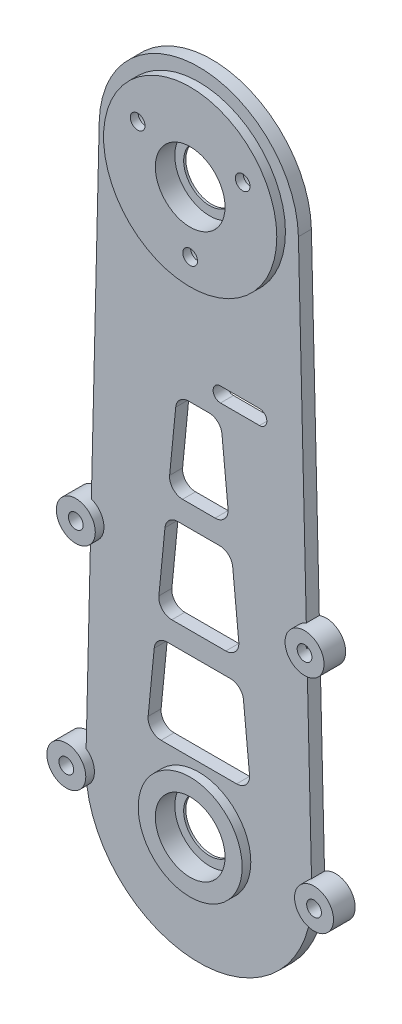
from build123d import *

# Parameters (mm, degrees)
SKETCH1_R           = 6
SKETCH1_R_2         = 1.7
BOSS_EXTRUDE1_DEPTH = 3
SKETCH2_R           = 20
SKETCH2_R_2         = 6
SKETCH2_R_3         = 1.7
BOSS_EXTRUDE2_DEPTH = 2
SKETCH3_R           = 12
SKETCH3_R_2         = 6
BOSS_EXTRUDE3_DEPTH = 2
SKETCH4_R           = 4.5
SKETCH4_R_2         = 1.7
BOSS_EXTRUDE4_DEPTH = 5
SKETCH5_R           = 4.5
SKETCH5_R_2         = 1.7
BOSS_EXTRUDE5_DEPTH = 5
SKETCH6_R           = 4.5
SKETCH6_R_2         = 1.7
BOSS_EXTRUDE6_DEPTH = 5
SKETCH7_R           = 4.5
SKETCH7_R_2         = 1.7
BOSS_EXTRUDE7_DEPTH = 5
SKETCH8_R           = 8.05
CUT_EXTRUDE1_DEPTH  = 4.5
SKETCH9_R           = 3.2
CUT_EXTRUDE2_DEPTH  = 3.2


with BuildPart() as part:
    # Sketch1 → Boss-Extrude1 (new body)
    with BuildSketch(Plane.XY.offset(328.5)):
        with BuildLine():
            Line((277.006534343, 300.548212638), (273.908821488, 170.622068635))
            ThreePointArc((273.908821488, 170.622068635), (300, 143.901406829), (326.091178512, 170.622068635))
            Line((326.091178512, 170.622068635), (322.993465657, 300.548212638))
            ThreePointArc((322.993465657, 300.548212638), (300, 323), (277.006534343, 300.548212638))
        make_face()
        with Locations((300, 300)):
            Circle(SKETCH1_R, mode=Mode.SUBTRACT)
        with Locations((300, 170)):
            Circle(SKETCH1_R, mode=Mode.SUBTRACT)
        with Locations((312.124355653, 307)):
            Circle(SKETCH1_R_2, mode=Mode.SUBTRACT)
        with Locations((287.875644347, 307)):
            Circle(SKETCH1_R_2, mode=Mode.SUBTRACT)
        with Locations((300, 286)):
            Circle(SKETCH1_R_2, mode=Mode.SUBTRACT)
        with BuildLine():
            Line((305, 258.3), (314, 258.3))
            ThreePointArc((314, 258.3), (315.7, 260), (314, 261.7))
            Line((314, 261.7), (305, 261.7))
            ThreePointArc((305, 261.7), (303.3, 260), (305, 258.3))
        make_face(mode=Mode.SUBTRACT)
        with BuildLine():
            Line((294.661250685, 252.292425307), (293.257422469, 237.959091974))
            ThreePointArc((293.257422469, 237.959091974), (294.02083171, 235.651384543), (296.243136361, 234.666666667))
            Line((296.243136361, 234.666666667), (303.756863639, 234.666666667))
            ThreePointArc((303.756863639, 234.666666667), (305.97916829, 235.651384543), (306.742577531, 237.959091974))
            Line((306.742577531, 237.959091974), (305.338749315, 252.292425307))
            ThreePointArc((305.338749315, 252.292425307), (304.368317547, 254.222304651), (302.353035423, 255))
            Line((302.353035423, 255), (297.646964577, 255))
            ThreePointArc((297.646964577, 255), (295.631682453, 254.222304651), (294.661250685, 252.292425307))
        make_face(mode=Mode.SUBTRACT)
        with BuildLine():
            Line((292.180065932, 226.959091974), (290.776237716, 212.625758641))
            ThreePointArc((290.776237716, 212.625758641), (291.539646956, 210.318051209), (293.761951607, 209.333333333))
            Line((293.761951607, 209.333333333), (306.238048393, 209.333333333))
            ThreePointArc((306.238048393, 209.333333333), (308.460353044, 210.318051209), (309.223762284, 212.625758641))
            Line((309.223762284, 212.625758641), (307.819934068, 226.959091974))
            ThreePointArc((307.819934068, 226.959091974), (306.849502301, 228.888971317), (304.834220177, 229.666666667))
            Line((304.834220177, 229.666666667), (295.165779823, 229.666666667))
            ThreePointArc((295.165779823, 229.666666667), (293.150497699, 228.888971317), (292.180065932, 226.959091974))
        make_face(mode=Mode.SUBTRACT)
        with BuildLine():
            Line((289.698881178, 201.625758641), (288.295052962, 187.292425307))
            ThreePointArc((288.295052962, 187.292425307), (289.058462202, 184.984717876), (291.280766853, 184))
            Line((291.280766853, 184), (308.719233147, 184))
            ThreePointArc((308.719233147, 184), (310.941537798, 184.984717876), (311.704947038, 187.292425307))
            Line((311.704947038, 187.292425307), (310.301118822, 201.625758641))
            ThreePointArc((310.301118822, 201.625758641), (309.330687055, 203.555637984), (307.315404931, 204.333333333))
            Line((307.315404931, 204.333333333), (292.684595069, 204.333333333))
            ThreePointArc((292.684595069, 204.333333333), (290.669312945, 203.555637984), (289.698881178, 201.625758641))
        make_face(mode=Mode.SUBTRACT)
    extrude(amount=BOSS_EXTRUDE1_DEPTH)

    # Sketch2 → Boss-Extrude2 (add)
    with BuildSketch(Plane.XY.offset(331.5)):
        with Locations((300, 300)):
            Circle(SKETCH2_R)
        with Locations((300, 300)):
            Circle(SKETCH2_R_2, mode=Mode.SUBTRACT)
        with Locations((312.124355653, 307)):
            Circle(SKETCH2_R_3, mode=Mode.SUBTRACT)
        with Locations((287.875644347, 307)):
            Circle(SKETCH2_R_3, mode=Mode.SUBTRACT)
        with Locations((300, 286)):
            Circle(SKETCH2_R_3, mode=Mode.SUBTRACT)
    extrude(amount=BOSS_EXTRUDE2_DEPTH)

    # Sketch3 → Boss-Extrude3 (add)
    with BuildSketch(Plane.XY.offset(331.5)):
        with Locations((300, 170)):
            Circle(SKETCH3_R)
        with Locations((300, 170)):
            Circle(SKETCH3_R_2, mode=Mode.SUBTRACT)
    extrude(amount=BOSS_EXTRUDE3_DEPTH)

    # Sketch4 → Boss-Extrude4 (add)
    with BuildSketch(Plane.XY.offset(328.5)):
        with Locations(Location((273.593173433, 220, 0), (0, 0, 288.004143267))):
            Circle(SKETCH4_R)
        with Locations(Location((273.593173433, 220, 0), (0, 0, 330.029047181))):
            Circle(SKETCH4_R_2, mode=Mode.SUBTRACT)
    extrude(amount=BOSS_EXTRUDE4_DEPTH)

    # Sketch5 → Boss-Extrude5 (add)
    with BuildSketch(Plane.XY.offset(328.5)):
        with Locations(Location((326.406826567, 220, 0), (0, 0, 110.735729818))):
            Circle(SKETCH5_R)
        with Locations(Location((326.406826567, 220, 0), (0, 0, 152.760633732))):
            Circle(SKETCH5_R_2, mode=Mode.SUBTRACT)
    extrude(amount=BOSS_EXTRUDE5_DEPTH)

    # Sketch6 → Boss-Extrude6 (add)
    with BuildSketch(Plane.XY.offset(328.5)):
        with Locations(Location((271.401406829, 170, 0), (0, 0, 55.009544434))):
            Circle(SKETCH6_R)
        with Locations((271.401406829, 170)):
            Circle(SKETCH6_R_2, mode=Mode.SUBTRACT)
    extrude(amount=BOSS_EXTRUDE6_DEPTH)

    # Sketch7 → Boss-Extrude7 (add)
    with BuildSketch(Plane.XY.offset(328.5)):
        with Locations(Location((328.598593171, 170, 0), (0, 0, 232.414236235))):
            Circle(SKETCH7_R)
        with Locations((328.598593171, 170)):
            Circle(SKETCH7_R_2, mode=Mode.SUBTRACT)
    extrude(amount=BOSS_EXTRUDE7_DEPTH)

    # Sketch8 → Cut-Extrude1 (cut)
    with BuildSketch(Plane.XY.offset(329)):
        with Locations((300, 300)):
            Circle(SKETCH8_R)
        with Locations((300, 170)):
            Circle(SKETCH8_R)
    extrude(amount=CUT_EXTRUDE1_DEPTH, mode=Mode.SUBTRACT)

    # Sketch9 → Cut-Extrude2 (cut)
    with BuildSketch(Plane.XY.offset(328.5)):
        with Locations((312.124355653, 307)):
            Circle(SKETCH9_R)
        with Locations((287.875644347, 307)):
            Circle(SKETCH9_R)
        with Locations((300, 286)):
            Circle(SKETCH9_R)
    extrude(amount=CUT_EXTRUDE2_DEPTH, mode=Mode.SUBTRACT)


solid = part.part
